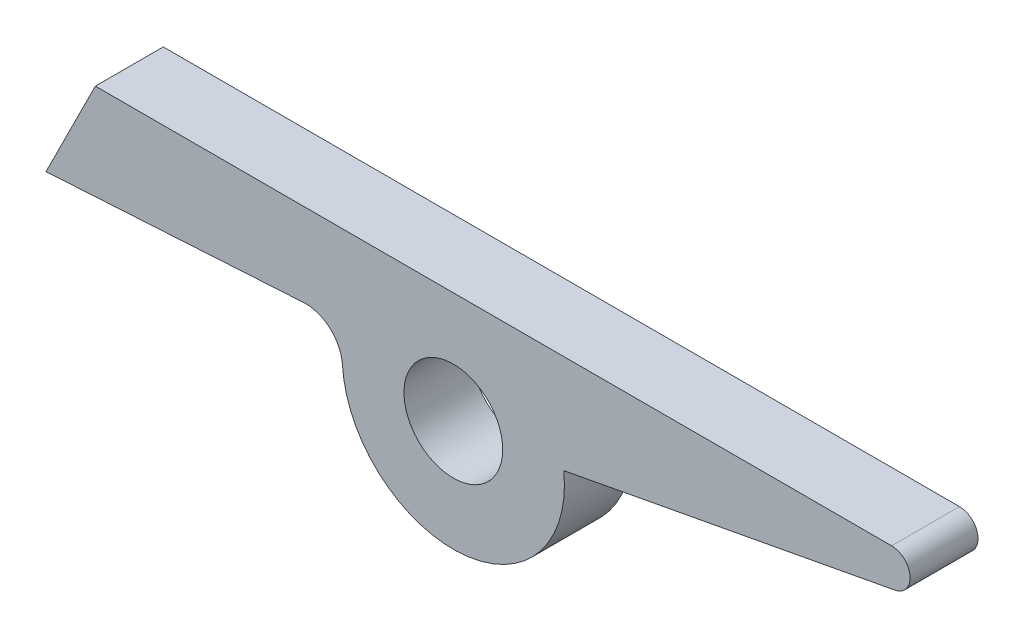
from build123d import *

# Parameters (mm, degrees)
SKETCH1_R           = 4
BOSS_EXTRUDE1_DEPTH = 5.5


with BuildPart() as part:
    # Sketch1 → Boss-Extrude1 (new body)
    with BuildSketch(Plane.XY):
        with BuildLine():
            ThreePointArc((-12.335531392, 2.238518271), (-12.156668127, 2.254624752), (-11.9771616, 2.26))
            ThreePointArc((-11.9771616, 2.26), (-9.922289344, 1.445749302), (-8.982871201, -0.554999992))
            ThreePointArc((-8.982871201, -0.554999992), (0.778132217, -8.966298582), (8.944184276, 1.000783512))
            Line((8.944184276, 1.000783512), (35.778917143, 6.025625378))
            ThreePointArc((35.778917143, 6.025625378), (36.996418316, 7.638632727), (35.5028384, 9))
            Line((35.5028384, 9), (-28.9971616, 9))
            Line((-28.9971616, 9), (-32.9971616, 1))
            Line((-32.9971616, 1), (-12.335531392, 2.238518271))
        make_face()
        Circle(SKETCH1_R, mode=Mode.SUBTRACT)
    extrude(amount=BOSS_EXTRUDE1_DEPTH)


solid = part.part
